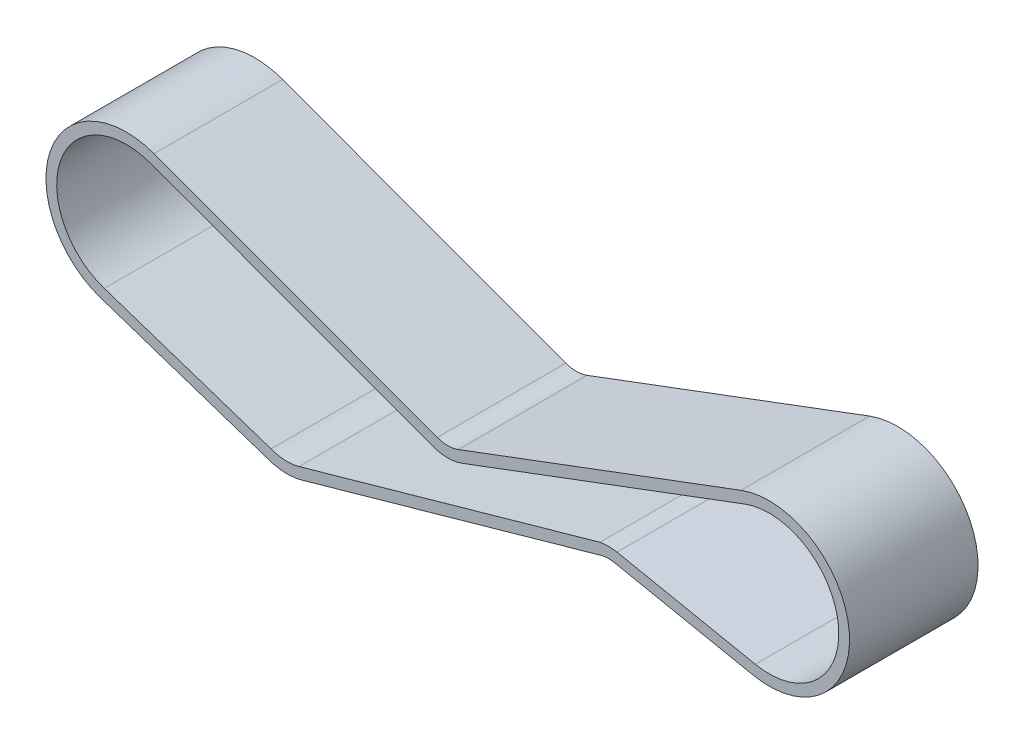
from build123d import *

# Parameters (mm, degrees)
BOSS_EXTRUDE1_DEPTH = 12


with BuildPart() as part:
    # Sketch1 → Boss-Extrude1 (new body)
    with BuildSketch(Plane.XY):
        with BuildLine():
            Line((0.477214368, -2.672855337), (26.843355259, 7.215507779))
            ThreePointArc((26.843355259, 7.215507779), (36.953291517, 0.789364626), (27.989636176, -7.157899677))
            Line((27.989636176, -7.157899677), (15.076637928, -4.54511037))
            ThreePointArc((15.076637928, -4.54511037), (14.494851923, -4.485141012), (13.912410709, -4.538371753))
            Line((13.912410709, -4.538371753), (-14.128816251, -12.448152272))
            ThreePointArc((-14.128816251, -12.448152272), (-15.750958715, -12.635893161), (-17.350003272, -12.304759779))
            Line((-17.350003272, -12.304759779), (-32.894889614, -7.121812332))
            ThreePointArc((-32.894889614, -7.121812332), (-37.600806958, 2.472956777), (-27.935809428, 7.032899219))
            Line((-27.935809428, 7.032899219), (-1.504706088, -2.679457675))
            ThreePointArc((-1.504706088, -2.679457675), (-0.513152862, -2.854165557), (0.477214368, -2.672855337))
        make_face()
        with BuildLine():
            Line((-28.280719883, 6.094263625), (-1.849616543, -3.618093269))
            ThreePointArc((-1.849616543, -3.618093269), (-0.509821597, -3.854160008), (0.82837082, -3.609172135))
            Line((0.82837082, -3.609172135), (27.194511712, 6.279190981))
            ThreePointArc((27.194511712, 6.279190981), (35.956456468, 0.709866915), (28.187955173, -6.177762148))
            Line((28.187955173, -6.177762148), (15.274956925, -3.564972841))
            ThreePointArc((15.274956925, -3.564972841), (14.477361985, -3.485090396), (13.679767045, -3.564972841))
            Line((13.679767045, -3.564972841), (-14.400299195, -11.485709022))
            ThreePointArc((-14.400299195, -11.485709022), (-15.71642918, -11.636427946), (-17.012660358, -11.363116652))
            Line((-17.012660358, -11.363116652), (-32.578589422, -6.173153179))
            ThreePointArc((-32.578589422, -6.173153179), (-36.657051163, 2.142313468), (-28.280719883, 6.094263625))
        make_face(mode=Mode.SUBTRACT)
    extrude(amount=BOSS_EXTRUDE1_DEPTH)


solid = part.part
